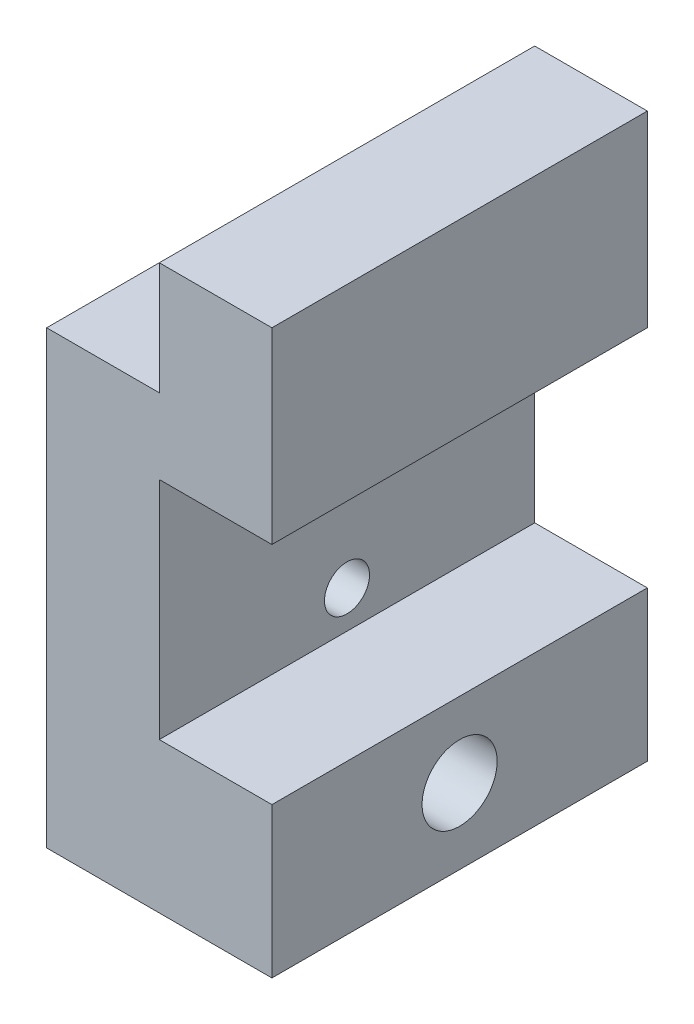
from build123d import *

# Parameters (mm, degrees)
BOSS_EXTRUDE1_DEPTH = 50
SKETCH2_R           = 5
CUT_EXTRUDE1_DEPTH  = 50
SKETCH3_R           = 3
CUT_EXTRUDE2_DEPTH  = 101


with BuildPart() as part:
    # Sketch1 → Boss-Extrude1 (new body)
    with BuildSketch(Plane.XY):
        Polygon((30, 0), (0, 0), (0, 60), (15, 60), (15, 75), (30, 75), (30, 60), (30, 50), (15, 50), (15, 20), (30, 20), align=None)
    extrude(amount=-BOSS_EXTRUDE1_DEPTH)

    # Sketch2 → Cut-Extrude1 (cut)
    with BuildSketch(Plane(origin=(30, 0, 0), x_dir=(0, 0, -1), z_dir=(1, 0, 0))):
        with Locations((25, 10)):
            Circle(SKETCH2_R)
    extrude(amount=-CUT_EXTRUDE1_DEPTH, mode=Mode.SUBTRACT)

    # Sketch3 → Cut-Extrude2 (cut)
    with BuildSketch(Plane.ZY):
        with Locations((-25, 25)):
            Circle(SKETCH3_R)
    extrude(amount=-CUT_EXTRUDE2_DEPTH, mode=Mode.SUBTRACT)


solid = part.part
